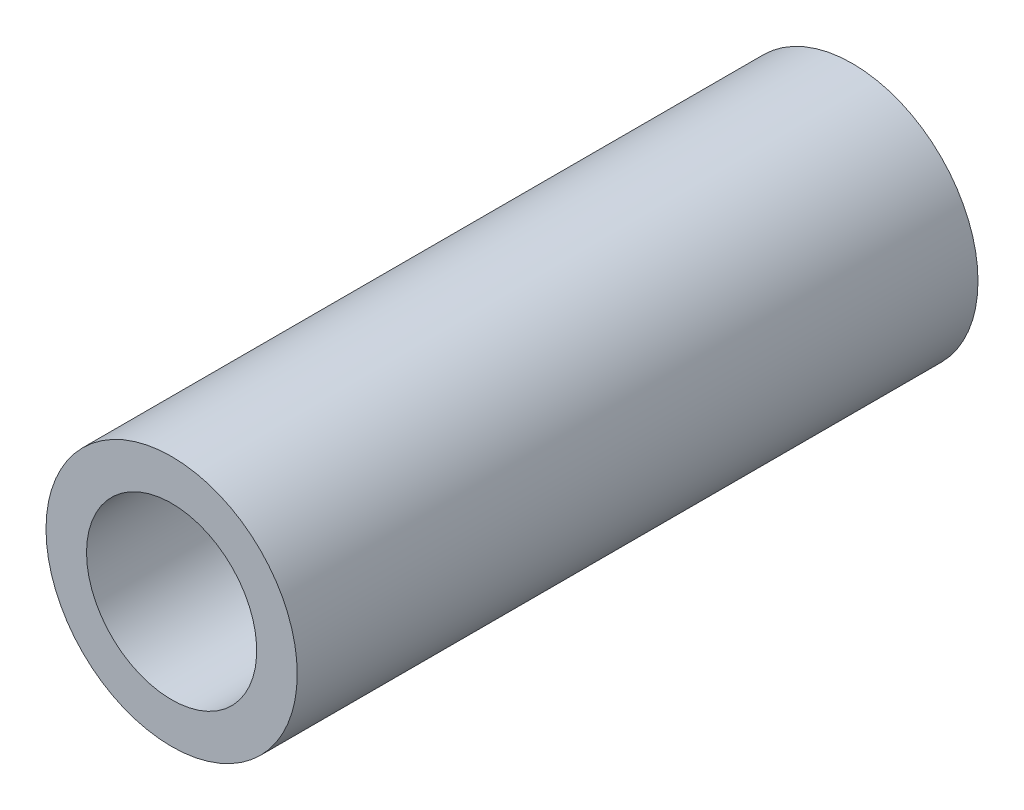
from build123d import *

# Parameters (mm, degrees)
SKETCH_1_R      = 15.5
SKETCH_1_R_2    = 10.5
EXTRUDE_1_DEPTH = 84


with BuildPart() as part:
    # Эскиз1 → Бобышка-Вытянуть1 (new body)
    with BuildSketch(Plane.XY):
        with Locations(Location((0, 0, 0), (0, 0, 180))):
            Circle(SKETCH_1_R)
        with Locations(Location((0, 0, 0), (0, 0, 180))):
            Circle(SKETCH_1_R_2, mode=Mode.SUBTRACT)
    extrude(amount=EXTRUDE_1_DEPTH)


solid = part.part
